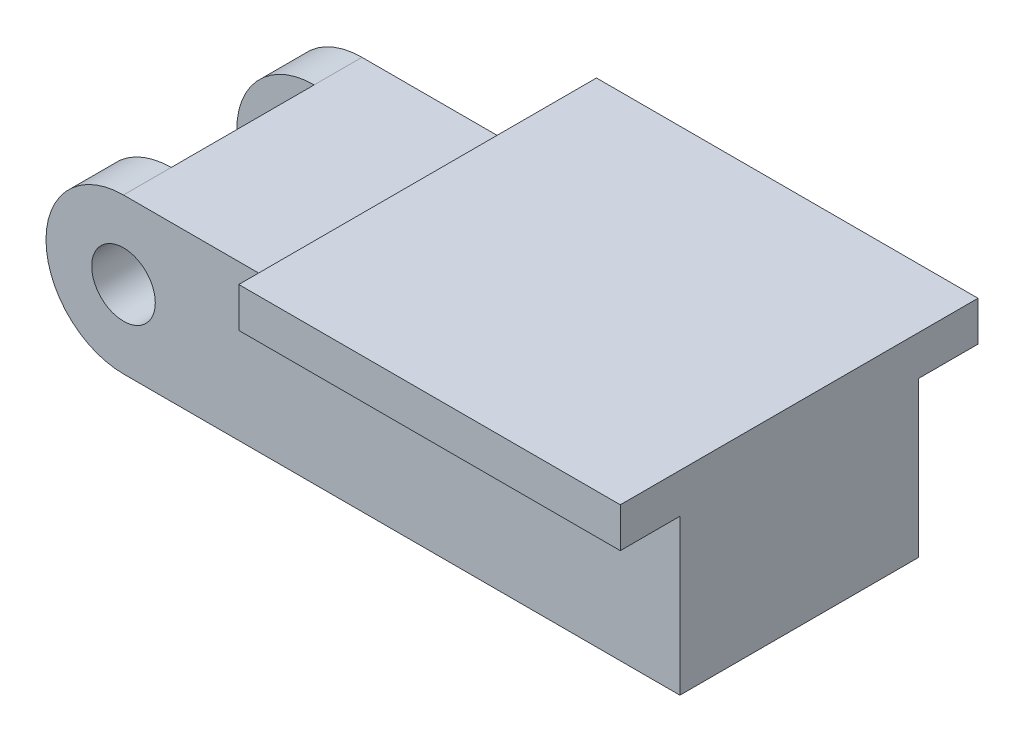
from build123d import *

# Parameters (mm, degrees)
SKETCH1_W           = 30
SKETCH1_H           = 19.5
BOSS_EXTRUDE1_DEPTH = 70
BOSS_EXTRUDE2_DEPTH = 30
SKETCH7_W           = 48
SKETCH7_H           = 45
BOSS_EXTRUDE3_DEPTH = 5
CUT_EXTRUDE2_START  = -6
SKETCH8_R           = 9.75
CUT_EXTRUDE2_DEPTH  = 18
SKETCH9_R           = 4
CUT_EXTRUDE3_DEPTH  = 92.468915485
SKETCH10_R          = 9
CUT_EXTRUDE4_DEPTH  = 10
CUT_EXTRUDE6_START  = -6
CUT_EXTRUDE6_DEPTH  = 18
FILLET1_R           = 10


with BuildPart() as part:
    # Sketch1 → Boss-Extrude1 (new body)
    with BuildSketch(Plane(origin=(0, 0, 0), x_dir=(0, 0, -1), z_dir=(1, 0, 0))):
        with Locations((0, 9.75)):
            Rectangle(SKETCH1_W, SKETCH1_H)
    extrude(amount=-BOSS_EXTRUDE1_DEPTH)

    # Sketch6 → Boss-Extrude2 (add)
    with BuildSketch(Plane.XY.offset(15)):
        with BuildLine():
            Line((-70, 19.5), (-70, 0))
            ThreePointArc((-70, 0), (-79.75, 9.75), (-70, 19.5))
        make_face()
    extrude(amount=-BOSS_EXTRUDE2_DEPTH)

    # Sketch7 → Boss-Extrude3 (add)
    with BuildSketch(Plane(origin=(0, 19.5, 0), x_dir=(1, 0, 0), z_dir=(0, 1, 0))):
        with Locations((-24, 0)):
            Rectangle(SKETCH7_W, SKETCH7_H)
    extrude(amount=BOSS_EXTRUDE3_DEPTH)

    # Sketch8 → Cut-Extrude2 (cut)
    with BuildSketch(Plane.XY.offset(15).offset(CUT_EXTRUDE2_START)):
        with Locations((-70, 9.75)):
            Circle(SKETCH8_R)
    extrude(amount=-CUT_EXTRUDE2_DEPTH, mode=Mode.SUBTRACT)

    # Sketch9 → Cut-Extrude3 (cut, through all)
    with BuildSketch(Plane.XY.offset(15)):
        with Locations((-70, 9.75)):
            Circle(SKETCH9_R)
    extrude(amount=-CUT_EXTRUDE3_DEPTH, mode=Mode.SUBTRACT)

    # Sketch10 → Cut-Extrude4 (cut)
    with BuildSketch(Plane.XZ):
        with Locations(Location((-24, 0, 0), (0, 0, 270))):
            Circle(SKETCH10_R)
    extrude(amount=-CUT_EXTRUDE4_DEPTH, mode=Mode.SUBTRACT)

    # Sketch11 → Cut-Extrude6 (cut)
    with BuildSketch(Plane(origin=(0, 0, -15), x_dir=(-1, 0, 0), z_dir=(0, 0, -1)).offset(CUT_EXTRUDE6_START)):
        Polygon((66.561504355, 11.793709299), (45, 0), (70, 0), align=None)
    extrude(amount=-CUT_EXTRUDE6_DEPTH, mode=Mode.SUBTRACT)

    # Fillet1
    fillet1_edges = [part.edges().sort_by_distance(p)[0] for p in [
        (-60.344849532, 8.393324122, 0),
    ]]
    fillet(fillet1_edges, radius=FILLET1_R)


solid = part.part
